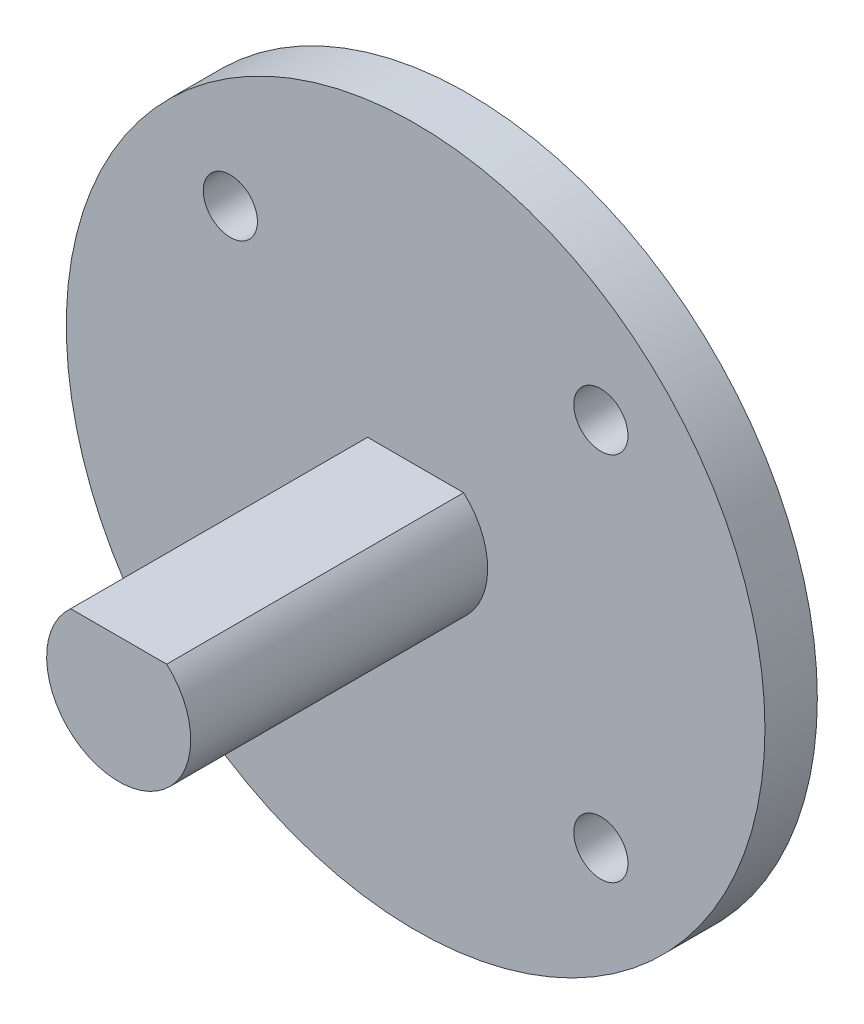
from build123d import *

# Parameters (mm, degrees)
SKETCH1_R           = 20
SKETCH1_R_2         = 1.55
BOSS_EXTRUDE1_DEPTH = 3
BOSS_EXTRUDE2_DEPTH = 20


with BuildPart() as part:
    # Sketch1 → Boss-Extrude1 (new body)
    with BuildSketch(Plane.XY):
        Circle(SKETCH1_R)
        with BuildLine():
            Line((-2.749545417, 3.075), (2.749545417, 3.075))
            ThreePointArc((2.749545417, 3.075), (0, -4.125), (-2.749545417, 3.075))
        make_face(mode=Mode.SUBTRACT)
        with Locations((-10.606601718, -10.606601718)):
            Circle(SKETCH1_R_2, mode=Mode.SUBTRACT)
        with Locations((10.606601718, -10.606601718)):
            Circle(SKETCH1_R_2, mode=Mode.SUBTRACT)
        with Locations((-10.606601718, 10.606601718)):
            Circle(SKETCH1_R_2, mode=Mode.SUBTRACT)
        with Locations((10.606601718, 10.606601718)):
            Circle(SKETCH1_R_2, mode=Mode.SUBTRACT)
    extrude(amount=BOSS_EXTRUDE1_DEPTH)

    # Sketch1<3> → Boss-Extrude2 (add)
    with BuildSketch(Plane.XY):
        with BuildLine():
            Line((2.749545417, 3.075), (-2.749545417, 3.075))
            ThreePointArc((-2.749545417, 3.075), (-1.684302549, -3.765468088), (4.125, 0))
            ThreePointArc((4.125, 0), (3.765468088, 1.684302549), (2.749545417, 3.075))
        make_face()
    extrude(amount=BOSS_EXTRUDE2_DEPTH)


solid = part.part
